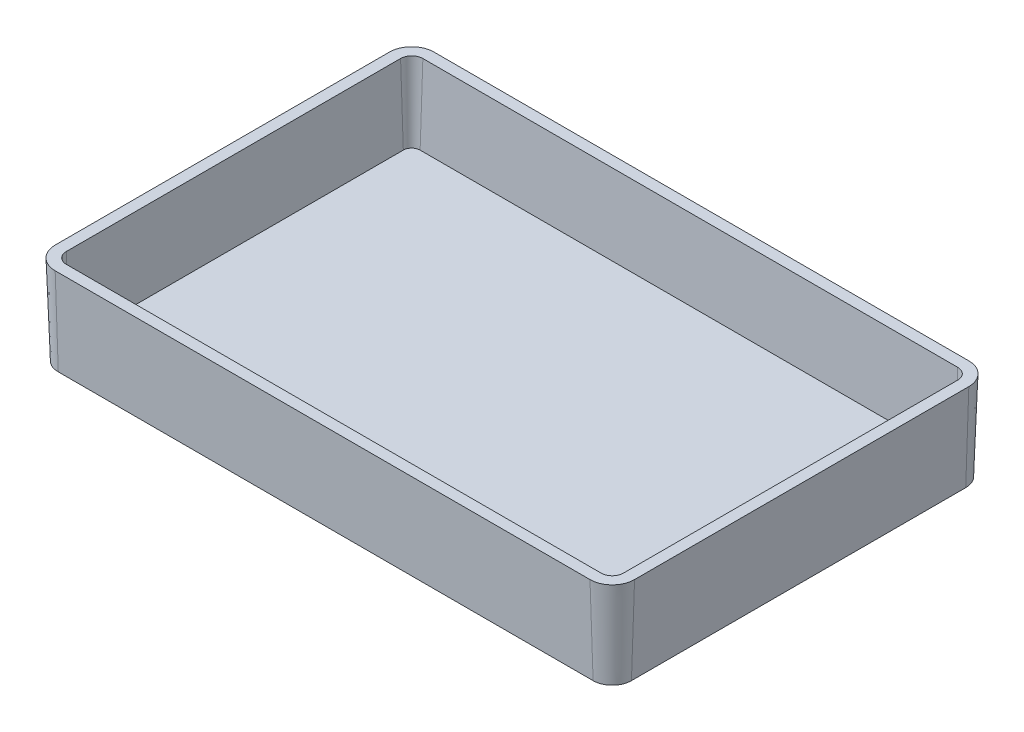
from build123d import *

# Parameters (mm, degrees)
BOSS_EXTRUDE1_DEPTH = 4
BOSS_EXTRUDE1_DRAFT = -2
SHELL1_T            = -0.5


with BuildPart() as part:
    # Sketch1 → Boss-Extrude1 (with draft: the straight prism first)
    with BuildSketch(Plane(origin=(0, 0, 0), x_dir=(1, 0, 0), z_dir=(0, 1, 0))):
        with BuildLine():
            Line((-12, -8.5), (12, -8.5))
            ThreePointArc((12, -8.5), (12.707106781, -8.207106781), (13, -7.5))
            Line((13, -7.5), (13, 7.5))
            ThreePointArc((13, 7.5), (12.707106781, 8.207106781), (12, 8.5))
            Line((12, 8.5), (-12, 8.5))
            ThreePointArc((-12, 8.5), (-12.707106781, 8.207106781), (-13, 7.5))
            Line((-13, 7.5), (-13, -7.5))
            ThreePointArc((-13, -7.5), (-12.707106781, -8.207106781), (-12, -8.5))
        make_face()
    extrude(amount=-BOSS_EXTRUDE1_DEPTH)
    # Boss-Extrude1: the draft: its side faces are tilted about the plane it starts from
    boss_extrude1_sides = [part.faces().sort_by_distance(p)[0] for p in [
        (0, -2, 8.5),
        (12.707106781, -2, 8.207106781),
        (13, -2, 0),
        (12.707106781, -2, -8.207106781),
        (0, -2, -8.5),
        (-12.707106781, -2, -8.207106781),
        (-13, -2, 0),
        (-12.707106781, -2, 8.207106781),
    ]]
    draft(boss_extrude1_sides, Plane(origin=(0, 0, 0), x_dir=(1, 0, 0), z_dir=(0, 1, 0)), BOSS_EXTRUDE1_DRAFT)

    # Shell1
    shell1_openings = [part.faces().sort_by_distance(p)[0] for p in [
        (0, 0, 0),
    ]]
    offset(amount=SHELL1_T, openings=shell1_openings, kind=Kind.INTERSECTION)


solid = part.part
